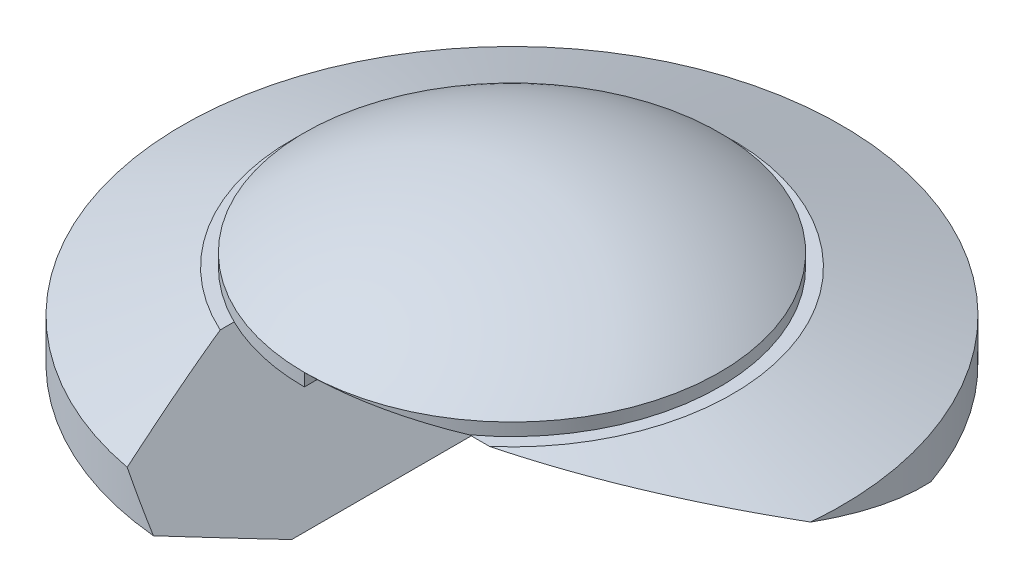
from build123d import *

# Parameters (mm, degrees)
CROQUIS1_R              = 52.5
SALIENTE_EXTRUIR1_DEPTH = 10
SALIENTE_EXTRUIR1_DRAFT = -69
CROQUIS2_R              = 78.550890647
SALIENTE_EXTRUIR2_DEPTH = 10
CROQUIS3_R              = 78.550890647
SALIENTE_EXTRUIR3_DEPTH = 10
SALIENTE_EXTRUIR3_TAPER = 69
CROQUIS4_R              = 49.5
SALIENTE_EXTRUIR4_DEPTH = 3
C_PULA1_FACE_RADIUS     = 49.5
C_PULA1_HEIGHT          = 16
CORTAR_EXTRUIR1_DEPTH   = 122.414516736
CORTAR_EXTRUIR3_REACH   = 184.352
SALIENTE_EXTRUIR5_DEPTH = 6
MATRIZL1_COUNT          = 2
MATRIZL1_PITCH          = 40


with BuildPart() as part:
    # Croquis1 → Saliente-Extruir1 (with draft: the straight prism first)
    with BuildSketch(Plane(origin=(0, 0, 0), x_dir=(1, 0, 0), z_dir=(0, 1, 0))):
        Circle(CROQUIS1_R)
    extrude(amount=SALIENTE_EXTRUIR1_DEPTH)
    # Saliente-Extruir1: the draft: its side faces are tilted about the plane it starts from
    saliente_extruir1_sides = [part.faces().sort_by_distance(p)[0] for p in [
        (-52.5, 5, 0),
    ]]
    draft(saliente_extruir1_sides, Plane(origin=(0, 0, 0), x_dir=(1, 0, 0), z_dir=(0, 1, 0)), SALIENTE_EXTRUIR1_DRAFT)

    # Croquis2 → Saliente-Extruir2 (add)
    with BuildSketch(Plane(origin=(0, 10, 0), x_dir=(1, 0, 0), z_dir=(0, 1, 0))):
        with Locations(Location((0, 0, 0), (0, 0, 270))):
            Circle(CROQUIS2_R)
    extrude(amount=SALIENTE_EXTRUIR2_DEPTH)

    # Croquis3 → Saliente-Extruir3 (add)
    with BuildSketch(Plane(origin=(0, 20, 0), x_dir=(1, 0, 0), z_dir=(0, 1, 0))):
        with Locations(Location((0, 0, 0), (0, 0, 270))):
            Circle(CROQUIS3_R)
    extrude(amount=SALIENTE_EXTRUIR3_DEPTH, taper=SALIENTE_EXTRUIR3_TAPER)

    # Croquis4 → Saliente-Extruir4 (add)
    with BuildSketch(Plane(origin=(0, 30, 0), x_dir=(1, 0, 0), z_dir=(0, 1, 0))):
        with Locations(Location((0, 0, 0), (0, 0, 270))):
            Circle(CROQUIS4_R)
    extrude(amount=SALIENTE_EXTRUIR4_DEPTH)

    # Cúpula1: a dome of height H over a round flat face of radius A is a cap of a sphere of radius (A * A + H * H) / (2 * H)
    c_pula1_r = (C_PULA1_FACE_RADIUS * C_PULA1_FACE_RADIUS + C_PULA1_HEIGHT * C_PULA1_HEIGHT) / (2 * C_PULA1_HEIGHT)
    c_pula1_base = Plane((0, 33, 0), z_dir=(0, 1, 0))
    with Locations(c_pula1_base.offset(C_PULA1_HEIGHT - c_pula1_r)):
        c_pula1_ball = Sphere(c_pula1_r, mode=Mode.PRIVATE)
    add(split(c_pula1_ball, bisect_by=c_pula1_base, keep=Keep.TOP, mode=Mode.PRIVATE))

    # Croquis6 → Cortar-Extruir1 (cut, through all)
    with BuildSketch(Plane(origin=(0, 0, 0), x_dir=(0, 0, -1), z_dir=(1, 0, 0))):
        Polygon((-49.5, 33), (55.064393683, 0.984378507), (52.5, 0), (-52.5, 0), (-78.550890647, 10), (-78.550890647, 20), align=None)
    extrude(amount=CORTAR_EXTRUIR1_DEPTH, mode=Mode.SUBTRACT)

    # Cortar-Extruir3: up to this plane
    cortar_extruir3_end = Plane(origin=(78.550890647, 33, 49.5), z_dir=(0, -0.9561843075173418, 0.2927653839810668))
    # Croquis9 → Cortar-Extruir3 (cut, up to the surface)
    with BuildSketch(Plane.XY.offset(78.550890647), mode=Mode.PRIVATE) as cortar_extruir3_sk1:
        Polygon((0, 0), (-21.79627584, 30), (0, 30), align=None)
    cortar_extruir3_tool1 = split(extrude(cortar_extruir3_sk1.sketch, amount=-CORTAR_EXTRUIR3_REACH, mode=Mode.PRIVATE), bisect_by=cortar_extruir3_end, keep=Keep.BOTH, mode=Mode.PRIVATE)
    add(cortar_extruir3_tool1.solids().sort_by_distance((-7.265425, 20, 78.550891))[0], mode=Mode.SUBTRACT)

    # Croquis11 → Saliente-Extruir5 (add)
    with BuildSketch(Plane.XY.offset(20)):
        Polygon((-63.346461172, 16.251599406), (-52.5, 0), (-41.36, 0), (-59.921256857, -15.574743783), (-77.919309928, 5.874500625), align=None)
    saliente_extruir5 = extrude(amount=SALIENTE_EXTRUIR5_DEPTH)

    # MatrizL1: Saliente-Extruir5 ×2
    with Locations(*[(0, 0, -i * MATRIZL1_PITCH) for i in range(1, MATRIZL1_COUNT)]):
        add(saliente_extruir5)


solid = part.part
